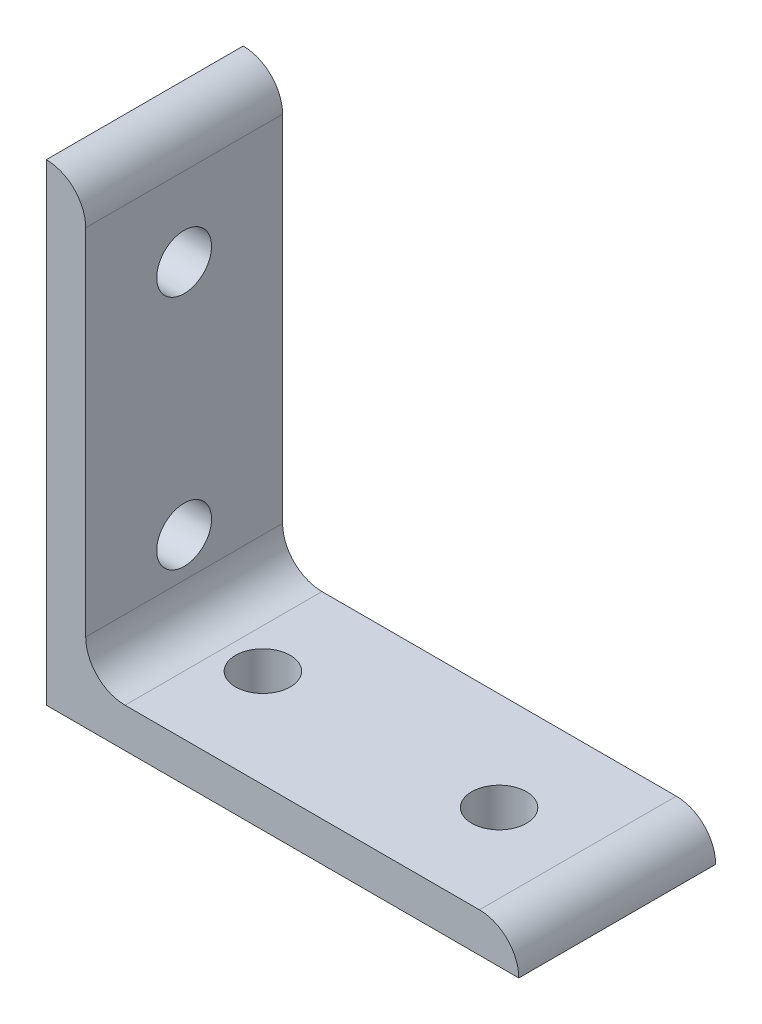
from build123d import *

# Parameters (mm, degrees)
BOSS_EXTRUDE1_DEPTH      = 15.875
S_0_348_DIAMETER_HOLE1_D = 8.8392
S_0_348_DIAMETER_HOLE2_D = 8.8392
FILLET1_R                = 6.35


with BuildPart() as part:
    # Sketch1 → Boss-Extrude1 (new, symmetric)
    with BuildSketch(Plane.XY):
        with BuildLine():
            Line((0, 0), (76.2, 0))
            ThreePointArc((76.2, 0), (74.340128061, 4.490128061), (69.85, 6.35))
            Line((69.85, 6.35), (6.35, 6.35))
            Line((6.35, 6.35), (6.35, 69.85))
            ThreePointArc((6.35, 69.85), (4.490128061, 74.340128061), (0, 76.2))
            Line((0, 76.2), (0, 0))
        make_face()
    extrude(amount=BOSS_EXTRUDE1_DEPTH, both=True)

    # S (0.348) Diameter Hole1 (through all)
    with Locations(Plane(origin=(6.35, 0, 0), x_dir=(0, 0, -1), z_dir=(1, 0, 0))):
        with Locations((0, 57.15), (0, 19.05)):
            Hole(S_0_348_DIAMETER_HOLE1_D / 2)

    # S (0.348) Diameter Hole2 (through all)
    with Locations(Plane(origin=(0, 6.35, 0), x_dir=(-1, 0, 0), z_dir=(0, 1, 0))):
        with Locations((-19.05, 0), (-57.15, 0)):
            Hole(S_0_348_DIAMETER_HOLE2_D / 2)

    # Fillet1
    fillet1_edges = [part.edges().sort_by_distance(p)[0] for p in [
        (6.35, 6.35, 0),
    ]]
    fillet(fillet1_edges, radius=FILLET1_R)


solid = part.part
